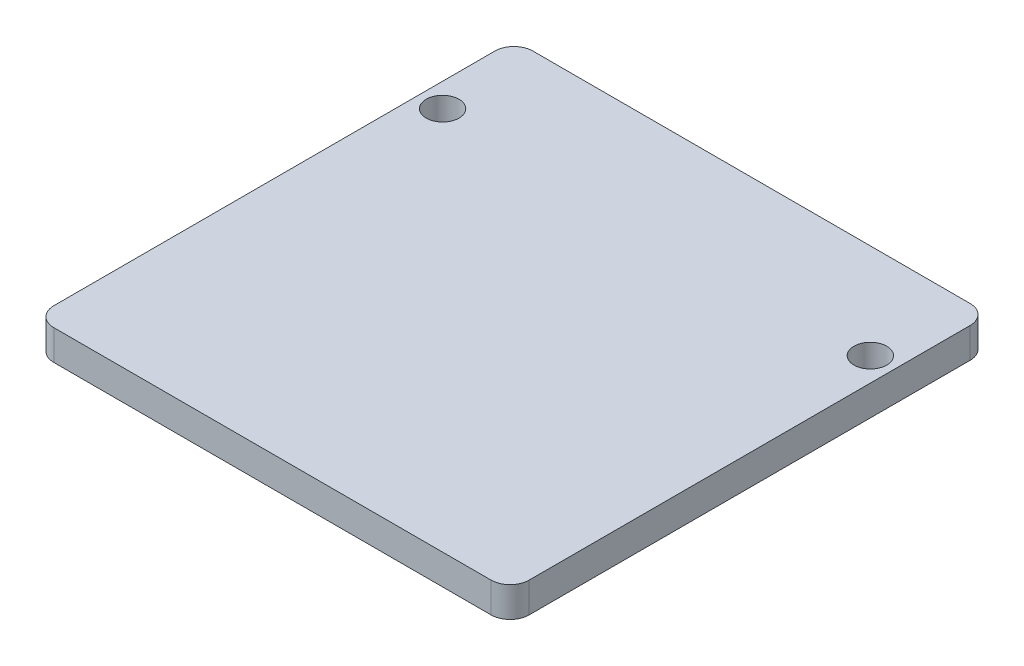
from build123d import *

# Parameters (mm, degrees)
SKETCH1_W           = 50
SKETCH1_H           = 25.4
SKETCH1_R           = 1.725
SKETCH1_H_2         = 25
BOSS_EXTRUDE1_DEPTH = 3.175
FILLET1_R           = 2


with BuildPart() as part:
    # Sketch1 → Boss-Extrude1 (new body)
    # profile 1 of 2: a face of its own
    with BuildSketch(Plane(origin=(0, 0, 0), x_dir=(1, 0, 0), z_dir=(0, 1, 0))):
        with Locations((22.5, -2.7)):
            Rectangle(SKETCH1_W, SKETCH1_H)
        with Locations(Location((0, 0, 0), (0, 0, 270))):
            Circle(SKETCH1_R, mode=Mode.SUBTRACT)
        with Locations(Location((45, 0, 0), (0, 0, 270))):
            Circle(SKETCH1_R, mode=Mode.SUBTRACT)
    # profile 2 of 2: a face of its own
    with BuildSketch(Plane(origin=(0, 0, 0), x_dir=(1, 0, 0), z_dir=(0, 1, 0))):
        with Locations((22.5, -27.9)):
            Rectangle(SKETCH1_W, SKETCH1_H_2)
    extrude(amount=BOSS_EXTRUDE1_DEPTH)

    # Fillet1
    fillet1_edges = [part.edges().sort_by_distance(p)[0] for p in [
        (47.5, 1.5875, 40.4),
        (-2.5, 1.5875, 40.4),
        (-2.5, 1.5875, -10),
        (47.5, 1.5875, -10),
    ]]
    fillet(fillet1_edges, radius=FILLET1_R)


solid = part.part
